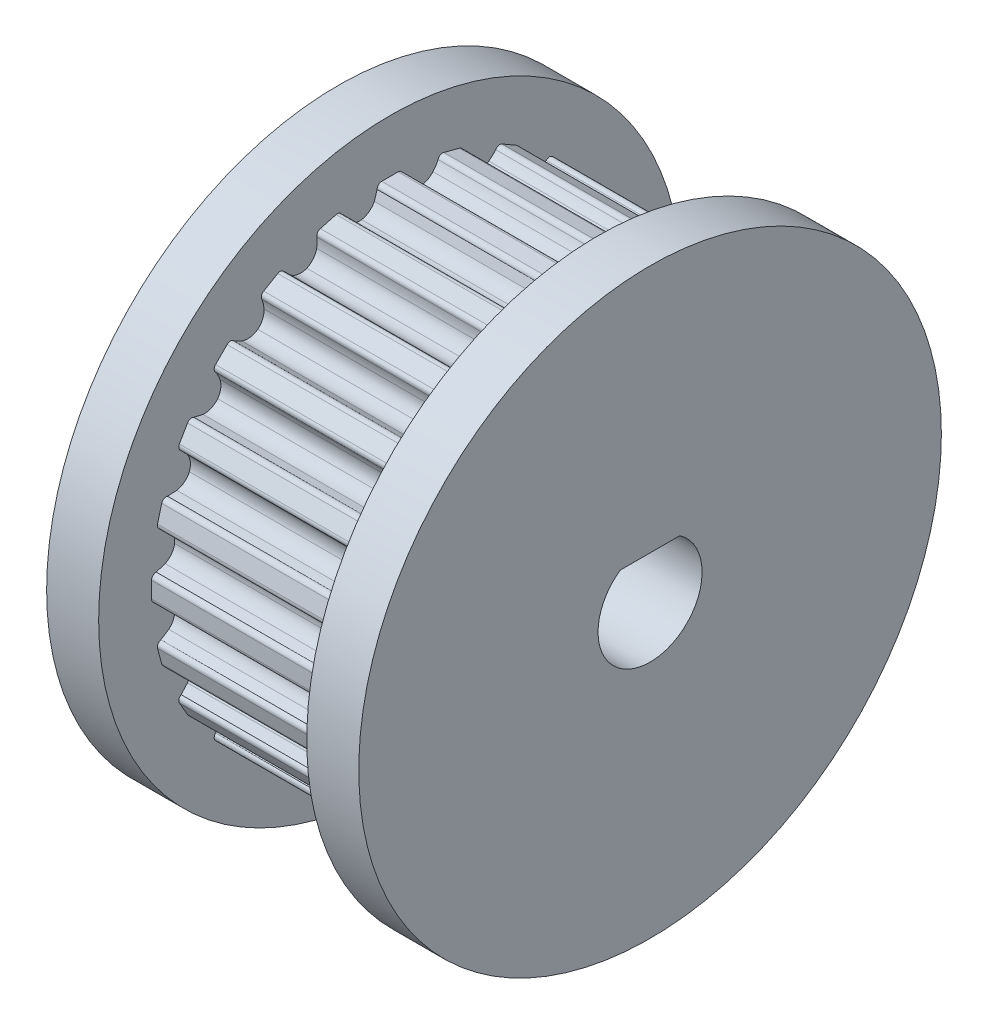
from build123d import *

# Parameters (mm, degrees)
EXTRUDE_1_DEPTH     = 20
SKETCH_2_R          = 28
EXTRUDE_2_DEPTH     = 5
EXTRUDE_START       = 5
SKETCH_3_R          = 28
EXTRUDE_3_DEPTH     = 5
CUT_EXTRUDE_1_DEPTH = 40


with BuildPart() as part:
    # 草图1 → 凸台-拉伸1 (new body)
    with BuildSketch(Plane(origin=(0, 0, 0), x_dir=(0, 0, -1), z_dir=(1, 0, 0))):
        with BuildLine():
            Line((1.454417232, 32.016494632), (1.184988456, 31.151887891))
            ThreePointArc((1.184988456, 31.151887891), (0.685118505, 30.54781702), (-0.035793848, 30.239503925))
            ThreePointArc((-0.035793848, 30.239503925), (-0.811939008, 30.35072566), (-1.45112135, 30.804837451))
            Line((-1.45112135, 30.804837451), (-1.935146255, 31.570250134))
            ThreePointArc((-1.935146255, 31.570250134), (-2.144812877, 31.843492995), (-2.486281447, 31.888448185))
            Line((-2.486281447, 31.888448185), (-4.000741114, 31.48264994))
            ThreePointArc((-4.000741114, 31.48264994), (-4.273983976, 31.272983318), (-4.318939166, 30.931514748))
            ThreePointArc((-4.318939166, 30.931514748), (-4.302833574, 30.477690966), (-4.355410688, 30.026635468))
            ThreePointArc((-4.355410688, 30.026635468), (-4.681902938, 29.31377195), (-5.298453497, 28.829378522))
            ThreePointArc((-5.298453497, 28.829378522), (-6.076938455, 28.735929319), (-6.811873967, 29.009135063))
            Line((-6.811873967, 29.009135063), (-7.477509503, 29.623192077))
            ThreePointArc((-7.477509503, 29.623192077), (-7.750752364, 29.832858699), (-8.092220934, 29.787903509))
            Line((-8.092220934, 29.787903509), (-9.450048326, 29.003961499))
            ThreePointArc((-9.450048326, 29.003961499), (-9.659714948, 28.730718637), (-9.614759758, 28.389250067))
            ThreePointArc((-9.614759758, 28.389250067), (-9.481744713, 27.955058389), (-9.415788552, 27.505764276))
            ThreePointArc((-9.415788552, 27.505764276), (-9.546653193, 26.732688581), (-10.016825056, 26.105225432))
            ThreePointArc((-10.016825056, 26.105225432), (-10.74459735, 25.813473699), (-11.525201391, 25.887154876))
            Line((-11.525201391, 25.887154876), (-12.327085596, 26.308009251))
            ThreePointArc((-12.327085596, 26.308009251), (-12.645283647, 26.4398112), (-12.963481699, 26.308009251))
            Line((-12.963481699, 26.308009251), (-14.072143121, 25.199347828))
            ThreePointArc((-14.072143121, 25.199347828), (-14.20394507, 24.881149777), (-14.072143121, 24.562951725))
            ThreePointArc((-14.072143121, 24.562951725), (-13.831283379, 24.177981597), (-13.651288746, 23.76106752))
            ThreePointArc((-13.651288746, 23.76106752), (-13.57760757, 22.98046348), (-13.869359302, 22.252691186))
            ThreePointArc((-13.869359302, 22.252691186), (-14.496822451, 21.782519323), (-15.269898146, 21.651654682))
            Line((-15.269898146, 21.651654682), (-16.153383937, 21.850625887))
            ThreePointArc((-16.153383937, 21.850625887), (-16.494852507, 21.895581078), (-16.768095369, 21.685914456))
            Line((-16.768095369, 21.685914456), (-17.552037379, 20.328087064))
            ThreePointArc((-17.552037379, 20.328087064), (-17.596992569, 19.986618494), (-17.387325947, 19.713375633))
            ThreePointArc((-17.387325947, 19.713375633), (-17.0550357, 19.403862132), (-16.773268933, 19.047740097))
            ThreePointArc((-16.773268933, 19.047740097), (-16.500063189, 18.312804585), (-16.593512392, 17.534319627))
            ThreePointArc((-16.593512392, 17.534319627), (-17.07790582, 16.917769068), (-17.790769338, 16.591276818))
            Line((-17.790769338, 16.591276818), (-18.695648618, 16.554805296))
            ThreePointArc((-18.695648618, 16.554805296), (-19.037117189, 16.509850106), (-19.24678381, 16.236607244))
            Line((-19.24678381, 16.236607244), (-19.652582055, 14.722147577))
            ThreePointArc((-19.652582055, 14.722147577), (-19.607626865, 14.380679006), (-19.334384004, 14.171012385))
            ThreePointArc((-19.334384004, 14.171012385), (-18.933308284, 13.958048345), (-18.568971321, 13.68698748))
            ThreePointArc((-18.568971321, 13.68698748), (-18.11485953, 13.047805138), (-18.003637795, 12.271659978))
            ThreePointArc((-18.003637795, 12.271659978), (-18.31195089, 11.550747625), (-18.916021761, 11.050877674))
            Line((-18.916021761, 11.050877674), (-19.780628503, 10.781448898))
            ThreePointArc((-19.780628503, 10.781448898), (-20.098826554, 10.649646949), (-20.230628503, 10.331448898))
            Line((-20.230628503, 10.331448898), (-20.230628503, 8.763564878))
            ThreePointArc((-20.230628503, 8.763564878), (-20.098826554, 8.445366826), (-19.780628503, 8.313564878))
            ThreePointArc((-19.780628503, 8.313564878), (-19.338099957, 8.211663447), (-18.916021761, 8.044136101))
            ThreePointArc((-18.916021761, 8.044136101), (-18.31195089, 7.54426615), (-18.003637795, 6.823353798))
            ThreePointArc((-18.003637795, 6.823353798), (-18.11485953, 6.047208637), (-18.568971321, 5.408026296))
            Line((-18.568971321, 5.408026296), (-19.334384004, 4.924001391))
            ThreePointArc((-19.334384004, 4.924001391), (-19.607626865, 4.714334769), (-19.652582055, 4.372866199))
            Line((-19.652582055, 4.372866199), (-19.24678381, 2.858406531))
            ThreePointArc((-19.24678381, 2.858406531), (-19.037117189, 2.58516367), (-18.695648618, 2.540208479))
            ThreePointArc((-18.695648618, 2.540208479), (-18.241824836, 2.556314071), (-17.790769338, 2.503736957))
            ThreePointArc((-17.790769338, 2.503736957), (-17.07790582, 2.177244707), (-16.593512392, 1.560694149))
            ThreePointArc((-16.593512392, 1.560694149), (-16.500063189, 0.78220919), (-16.773268933, 0.047273678))
            Line((-16.773268933, 0.047273678), (-17.387325947, -0.618361857))
            ThreePointArc((-17.387325947, -0.618361857), (-17.596992569, -0.891604719), (-17.552037379, -1.233073289))
            Line((-17.552037379, -1.233073289), (-16.768095369, -2.590900681))
            ThreePointArc((-16.768095369, -2.590900681), (-16.494852507, -2.800567302), (-16.153383937, -2.755612112))
            ThreePointArc((-16.153383937, -2.755612112), (-15.719192259, -2.622597067), (-15.269898146, -2.556640906))
            ThreePointArc((-15.269898146, -2.556640906), (-14.496822451, -2.687505547), (-13.869359302, -3.157677411))
            ThreePointArc((-13.869359302, -3.157677411), (-13.57760757, -3.885449704), (-13.651288746, -4.666053745))
            Line((-13.651288746, -4.666053745), (-14.072143121, -5.46793795))
            ThreePointArc((-14.072143121, -5.46793795), (-14.20394507, -5.786136002), (-14.072143121, -6.104334053))
            Line((-14.072143121, -6.104334053), (-12.963481699, -7.212995476))
            ThreePointArc((-12.963481699, -7.212995476), (-12.645283647, -7.344797424), (-12.327085596, -7.212995476))
            ThreePointArc((-12.327085596, -7.212995476), (-11.942115468, -6.972135733), (-11.525201391, -6.792141101))
            ThreePointArc((-11.525201391, -6.792141101), (-10.74459735, -6.718459924), (-10.016825056, -7.010211657))
            ThreePointArc((-10.016825056, -7.010211657), (-9.546653193, -7.637674806), (-9.415788552, -8.410750501))
            Line((-9.415788552, -8.410750501), (-9.614759758, -9.294236292))
            ThreePointArc((-9.614759758, -9.294236292), (-9.659714948, -9.635704862), (-9.450048326, -9.908947723))
            Line((-9.450048326, -9.908947723), (-8.092220934, -10.692889733))
            ThreePointArc((-8.092220934, -10.692889733), (-7.750752364, -10.737844923), (-7.477509503, -10.528178302))
            ThreePointArc((-7.477509503, -10.528178302), (-7.167996002, -10.195888055), (-6.811873967, -9.914121287))
            ThreePointArc((-6.811873967, -9.914121287), (-6.076938455, -9.640915543), (-5.298453497, -9.734364747))
            ThreePointArc((-5.298453497, -9.734364747), (-4.681902938, -10.218758175), (-4.355410688, -10.931621693))
            Line((-4.355410688, -10.931621693), (-4.318939166, -11.836500973))
            ThreePointArc((-4.318939166, -11.836500973), (-4.273983976, -12.177969543), (-4.000741114, -12.387636165))
            Line((-4.000741114, -12.387636165), (-2.486281447, -12.79343441))
            ThreePointArc((-2.486281447, -12.79343441), (-2.144812877, -12.74847922), (-1.935146255, -12.475236358))
            ThreePointArc((-1.935146255, -12.475236358), (-1.722182215, -12.074160638), (-1.45112135, -11.709823676))
            ThreePointArc((-1.45112135, -11.709823676), (-0.811939008, -11.255711884), (-0.035793848, -11.14449015))
            ThreePointArc((-0.035793848, -11.14449015), (0.685118505, -11.452803245), (1.184988456, -12.056874116))
            Line((1.184988456, -12.056874116), (1.454417232, -12.921480857))
            ThreePointArc((1.454417232, -12.921480857), (1.586219181, -13.239678909), (1.904417232, -13.371480857))
            Line((1.904417232, -13.371480857), (3.472301252, -13.371480857))
            ThreePointArc((3.472301252, -13.371480857), (3.790499304, -13.239678909), (3.922301252, -12.921480857))
            ThreePointArc((3.922301252, -12.921480857), (4.024202683, -12.478952312), (4.191730029, -12.056874116))
            ThreePointArc((4.191730029, -12.056874116), (4.69159998, -11.452803245), (5.412512332, -11.14449015))
            ThreePointArc((5.412512332, -11.14449015), (6.188657493, -11.255711884), (6.827839834, -11.709823676))
            Line((6.827839834, -11.709823676), (7.311864739, -12.475236358))
            ThreePointArc((7.311864739, -12.475236358), (7.521531361, -12.74847922), (7.862999931, -12.79343441))
            Line((7.862999931, -12.79343441), (9.377459599, -12.387636165))
            ThreePointArc((9.377459599, -12.387636165), (9.65070246, -12.177969543), (9.69565765, -11.836500973))
            ThreePointArc((9.69565765, -11.836500973), (9.679552058, -11.382677191), (9.732129173, -10.931621693))
            ThreePointArc((9.732129173, -10.931621693), (10.058621422, -10.218758175), (10.675171981, -9.734364747))
            ThreePointArc((10.675171981, -9.734364747), (11.45365694, -9.640915543), (12.188592451, -9.914121287))
            Line((12.188592451, -9.914121287), (12.854227987, -10.528178302))
            ThreePointArc((12.854227987, -10.528178302), (13.127470848, -10.737844923), (13.468939419, -10.692889733))
            Line((13.468939419, -10.692889733), (14.82676681, -9.908947723))
            ThreePointArc((14.82676681, -9.908947723), (15.036433432, -9.635704862), (14.991478242, -9.294236292))
            ThreePointArc((14.991478242, -9.294236292), (14.858463197, -8.860044614), (14.792507036, -8.410750501))
            ThreePointArc((14.792507036, -8.410750501), (14.923371677, -7.637674806), (15.393543541, -7.010211657))
            ThreePointArc((15.393543541, -7.010211657), (16.121315834, -6.718459924), (16.901919875, -6.792141101))
            Line((16.901919875, -6.792141101), (17.70380408, -7.212995476))
            ThreePointArc((17.70380408, -7.212995476), (18.022002132, -7.344797424), (18.340200183, -7.212995476))
            Line((18.340200183, -7.212995476), (19.448861606, -6.104334053))
            ThreePointArc((19.448861606, -6.104334053), (19.580663554, -5.786136002), (19.448861606, -5.46793795))
            ThreePointArc((19.448861606, -5.46793795), (19.208001863, -5.082967822), (19.028007231, -4.666053745))
            ThreePointArc((19.028007231, -4.666053745), (18.954326054, -3.885449704), (19.246077787, -3.157677411))
            ThreePointArc((19.246077787, -3.157677411), (19.873540936, -2.687505547), (20.646616631, -2.556640906))
            Line((20.646616631, -2.556640906), (21.530102421, -2.755612112))
            ThreePointArc((21.530102421, -2.755612112), (21.871570992, -2.800567302), (22.144813853, -2.590900681))
            Line((22.144813853, -2.590900681), (22.928755863, -1.233073289))
            ThreePointArc((22.928755863, -1.233073289), (22.973711053, -0.891604719), (22.764044431, -0.618361857))
            ThreePointArc((22.764044431, -0.618361857), (22.431754185, -0.308848357), (22.149987417, 0.047273678))
            ThreePointArc((22.149987417, 0.047273678), (21.876781673, 0.78220919), (21.970230877, 1.560694149))
            ThreePointArc((21.970230877, 1.560694149), (22.454624305, 2.177244707), (23.167487823, 2.503736957))
            Line((23.167487823, 2.503736957), (24.072367103, 2.540208479))
            ThreePointArc((24.072367103, 2.540208479), (24.413835673, 2.58516367), (24.623502295, 2.858406531))
            Line((24.623502295, 2.858406531), (25.02930054, 4.372866199))
            ThreePointArc((25.02930054, 4.372866199), (24.98434535, 4.714334769), (24.711102488, 4.924001391))
            ThreePointArc((24.711102488, 4.924001391), (24.310026768, 5.13696543), (23.945689806, 5.408026296))
            ThreePointArc((23.945689806, 5.408026296), (23.491578014, 6.047208637), (23.38035628, 6.823353798))
            ThreePointArc((23.38035628, 6.823353798), (23.688669375, 7.54426615), (24.292740245, 8.044136101))
            Line((24.292740245, 8.044136101), (25.157346987, 8.313564878))
            ThreePointArc((25.157346987, 8.313564878), (25.475545038, 8.445366826), (25.607346987, 8.763564878))
            Line((25.607346987, 8.763564878), (25.607346987, 10.331448898))
            ThreePointArc((25.607346987, 10.331448898), (25.475545038, 10.649646949), (25.157346987, 10.781448898))
            ThreePointArc((25.157346987, 10.781448898), (24.714818441, 10.883350328), (24.292740245, 11.050877674))
            ThreePointArc((24.292740245, 11.050877674), (23.688669375, 11.550747625), (23.38035628, 12.271659978))
            ThreePointArc((23.38035628, 12.271659978), (23.491578014, 13.047805138), (23.945689806, 13.68698748))
            Line((23.945689806, 13.68698748), (24.711102488, 14.171012385))
            ThreePointArc((24.711102488, 14.171012385), (24.98434535, 14.380679006), (25.02930054, 14.722147577))
            Line((25.02930054, 14.722147577), (24.623502295, 16.236607244))
            ThreePointArc((24.623502295, 16.236607244), (24.413835673, 16.509850106), (24.072367103, 16.554805296))
            ThreePointArc((24.072367103, 16.554805296), (23.618543321, 16.538699704), (23.167487823, 16.591276818))
            ThreePointArc((23.167487823, 16.591276818), (22.454624305, 16.917769068), (21.970230877, 17.534319627))
            ThreePointArc((21.970230877, 17.534319627), (21.876781673, 18.312804585), (22.149987417, 19.047740097))
            Line((22.149987417, 19.047740097), (22.764044431, 19.713375633))
            ThreePointArc((22.764044431, 19.713375633), (22.973711053, 19.986618494), (22.928755863, 20.328087064))
            Line((22.928755863, 20.328087064), (22.144813853, 21.685914456))
            ThreePointArc((22.144813853, 21.685914456), (21.871570992, 21.895581078), (21.530102421, 21.850625887))
            ThreePointArc((21.530102421, 21.850625887), (21.095910744, 21.717610842), (20.646616631, 21.651654682))
            ThreePointArc((20.646616631, 21.651654682), (19.873540936, 21.782519323), (19.246077787, 22.252691186))
            ThreePointArc((19.246077787, 22.252691186), (18.954326054, 22.98046348), (19.028007231, 23.76106752))
            Line((19.028007231, 23.76106752), (19.448861606, 24.562951725))
            ThreePointArc((19.448861606, 24.562951725), (19.580663554, 24.881149777), (19.448861606, 25.199347828))
            Line((19.448861606, 25.199347828), (18.340200183, 26.308009251))
            ThreePointArc((18.340200183, 26.308009251), (18.022002132, 26.4398112), (17.70380408, 26.308009251))
            ThreePointArc((17.70380408, 26.308009251), (17.318833952, 26.067149509), (16.901919875, 25.887154876))
            ThreePointArc((16.901919875, 25.887154876), (16.121315834, 25.813473699), (15.393543541, 26.105225432))
            ThreePointArc((15.393543541, 26.105225432), (14.923371677, 26.732688581), (14.792507036, 27.505764276))
            Line((14.792507036, 27.505764276), (14.991478242, 28.389250067))
            ThreePointArc((14.991478242, 28.389250067), (15.036433432, 28.730718637), (14.82676681, 29.003961499))
            Line((14.82676681, 29.003961499), (13.468939419, 29.787903509))
            ThreePointArc((13.468939419, 29.787903509), (13.127470848, 29.832858699), (12.854227987, 29.623192077))
            ThreePointArc((12.854227987, 29.623192077), (12.544714487, 29.29090183), (12.188592451, 29.009135063))
            ThreePointArc((12.188592451, 29.009135063), (11.45365694, 28.735929319), (10.675171981, 28.829378522))
            ThreePointArc((10.675171981, 28.829378522), (10.058621422, 29.31377195), (9.732129173, 30.026635468))
            Line((9.732129173, 30.026635468), (9.69565765, 30.931514748))
            ThreePointArc((9.69565765, 30.931514748), (9.65070246, 31.272983318), (9.377459599, 31.48264994))
            Line((9.377459599, 31.48264994), (7.862999931, 31.888448185))
            ThreePointArc((7.862999931, 31.888448185), (7.521531361, 31.843492995), (7.311864739, 31.570250134))
            ThreePointArc((7.311864739, 31.570250134), (7.0989007, 31.169174414), (6.827839834, 30.804837451))
            ThreePointArc((6.827839834, 30.804837451), (6.188657493, 30.35072566), (5.412512332, 30.239503925))
            ThreePointArc((5.412512332, 30.239503925), (4.69159998, 30.54781702), (4.191730029, 31.151887891))
            ThreePointArc((4.191730029, 31.151887891), (4.024202683, 31.573966087), (3.922301252, 32.016494632))
            ThreePointArc((3.922301252, 32.016494632), (3.790499304, 32.334692684), (3.472301252, 32.466494632))
            Line((3.472301252, 32.466494632), (1.904417232, 32.466494632))
            ThreePointArc((1.904417232, 32.466494632), (1.586219181, 32.334692684), (1.454417232, 32.016494632))
        make_face()
    extrude(amount=EXTRUDE_1_DEPTH)

    # 草图2 → 凸台-拉伸2 (add)
    with BuildSketch(Plane(origin=(20, 0, 0), x_dir=(0, 0, -1), z_dir=(1, 0, 0))):
        with Locations((2.688359242, 9.547506888)):
            Circle(SKETCH_2_R)
    extrude(amount=EXTRUDE_2_DEPTH)

    # 草图3 → 凸台-拉伸3 (add)
    with BuildSketch(Plane.ZY.offset(EXTRUDE_START)):
        with Locations(Location((-2.688359242, 9.547506888, 0), (0, 0, 180))):
            Circle(SKETCH_3_R)
    extrude(amount=-EXTRUDE_3_DEPTH)

    # 草图4 → 切除-拉伸1 (cut)
    with BuildSketch(Plane(origin=(25, 0, 0), x_dir=(0, 0, -1), z_dir=(1, 0, 0))):
        with BuildLine():
            Line((-0.179446134, 13.643320888), (5.556164618, 13.643320888))
            ThreePointArc((5.556164618, 13.643320888), (2.688359242, 4.547506888), (-0.179446134, 13.643320888))
        make_face()
    extrude(amount=-CUT_EXTRUDE_1_DEPTH, mode=Mode.SUBTRACT)


solid = part.part
